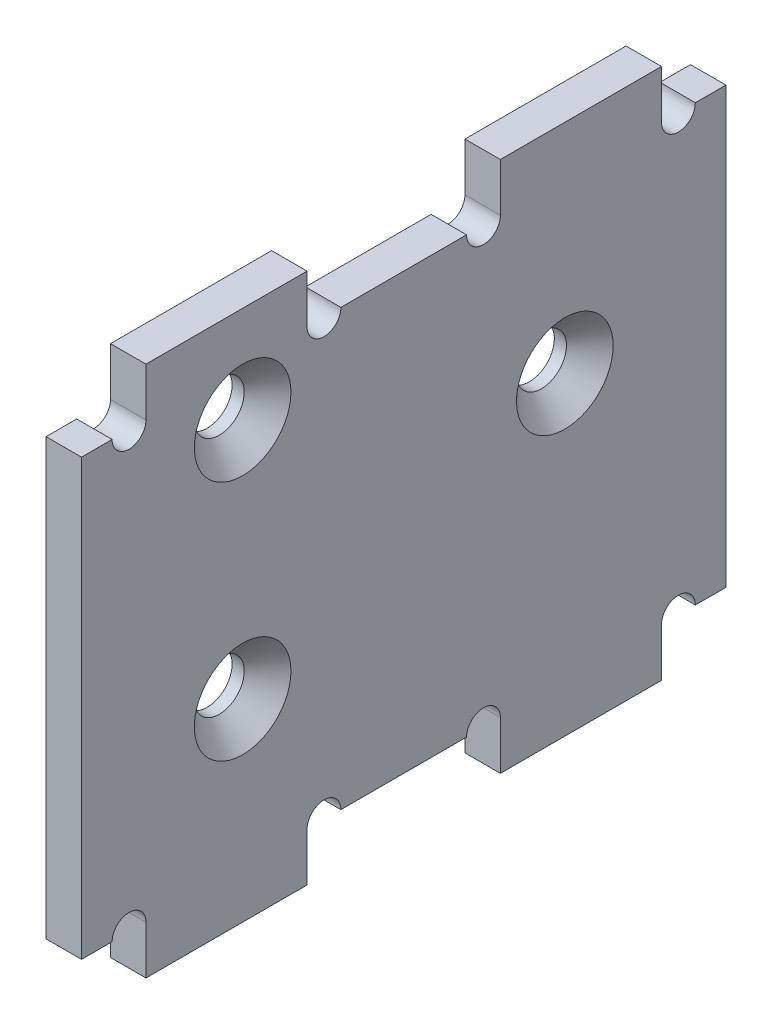
from build123d import *

# Parameters (mm, degrees)
SKETCH_1_R               = 1.55
EXTRUDE_1_DEPTH          = 2.2
HOLE_WIZARD_1_AT_2_COUNT = 2
HOLE_WIZARD_1_AT_2_PITCH = 21.360009363
HOLE_WIZARD_1_AT_3_COUNT = 2
HOLE_WIZARD_1_AT_3_PITCH = 15


with BuildPart() as part:
    # 草图1 → 凸台-拉伸1 (new body)
    with BuildSketch(Plane(origin=(0, 0, 0), x_dir=(0, 0, -1), z_dir=(1, 0, 0))):
        with BuildLine():
            Line((-16, 16.5), (-16, 13.5))
            ThreePointArc((-16, 13.5), (-17.05, 12.45), (-18.1, 13.5))
            Line((-18.1, 13.5), (-20, 13.5))
            Line((-20, 13.5), (-20, -13.5))
            Line((-20, -13.5), (-18.1, -13.5))
            ThreePointArc((-18.1, -13.5), (-17.05, -12.45), (-16, -13.5))
            Line((-16, -13.5), (-16, -16.5))
            Line((-16, -16.5), (-6, -16.5))
            Line((-6, -16.5), (-6, -13.5))
            ThreePointArc((-6, -13.5), (-4.95, -12.45), (-3.9, -13.5))
            Line((-3.9, -13.5), (3.9, -13.5))
            ThreePointArc((3.9, -13.5), (4.95, -12.45), (6, -13.5))
            Line((6, -13.5), (6, -16.5))
            Line((6, -16.5), (16, -16.5))
            Line((16, -16.5), (16, -13.5))
            ThreePointArc((16, -13.5), (17.05, -12.45), (18.1, -13.5))
            Line((18.1, -13.5), (20, -13.5))
            Line((20, -13.5), (20, 13.5))
            Line((20, 13.5), (18.1, 13.5))
            ThreePointArc((18.1, 13.5), (17.05, 12.45), (16, 13.5))
            Line((16, 13.5), (16, 16.5))
            Line((16, 16.5), (6, 16.5))
            Line((6, 16.5), (6, 13.5))
            ThreePointArc((6, 13.5), (4.95, 12.45), (3.9, 13.5))
            Line((3.9, 13.5), (-3.9, 13.5))
            ThreePointArc((-3.9, 13.5), (-4.95, 12.45), (-6, 13.5))
            Line((-6, 13.5), (-6, 16.5))
            Line((-6, 16.5), (-16, 16.5))
        make_face()
        with Locations((-10, -4.5)):
            Circle(SKETCH_1_R, mode=Mode.SUBTRACT)
        with Locations((-10, 10.5)):
            Circle(SKETCH_1_R, mode=Mode.SUBTRACT)
        with Locations((10, 3)):
            Circle(SKETCH_1_R, mode=Mode.SUBTRACT)
    extrude(amount=EXTRUDE_1_DEPTH)

    # 草图2 → 打孔尺寸(%根据十字)槽沉头木螺钉的类型1 (revolve, cut)
    with BuildSketch(Plane(origin=(2.2, 10.5, 10), x_dir=(0, 0, -1), z_dir=(0, 1, 0))):
        Polygon((0, 0), (0, 2.2), (1.55, 2.2), (1.55, 1.45), (3, 0), align=None)
    hole_wizard_1 = revolve(axis=Axis((8.55, 10.5, 10), (-1, 0, 0)), mode=Mode.SUBTRACT)

    # 打孔尺寸(%根据十字)槽沉头木螺钉的类型1 at 2: 打孔尺寸(%根据十字)槽沉头木螺钉的类型1 ×2
    with Locations(*[Vector(0, -0.3511234415883914, -0.9363291775690447) * (i * HOLE_WIZARD_1_AT_2_PITCH) for i in range(1, HOLE_WIZARD_1_AT_2_COUNT)]):
        add(hole_wizard_1, mode=Mode.SUBTRACT)

    # 打孔尺寸(%根据十字)槽沉头木螺钉的类型1 at 3: 打孔尺寸(%根据十字)槽沉头木螺钉的类型1 ×2
    with Locations(*[(0, -i * HOLE_WIZARD_1_AT_3_PITCH, 0) for i in range(1, HOLE_WIZARD_1_AT_3_COUNT)]):
        add(hole_wizard_1, mode=Mode.SUBTRACT)


solid = part.part
